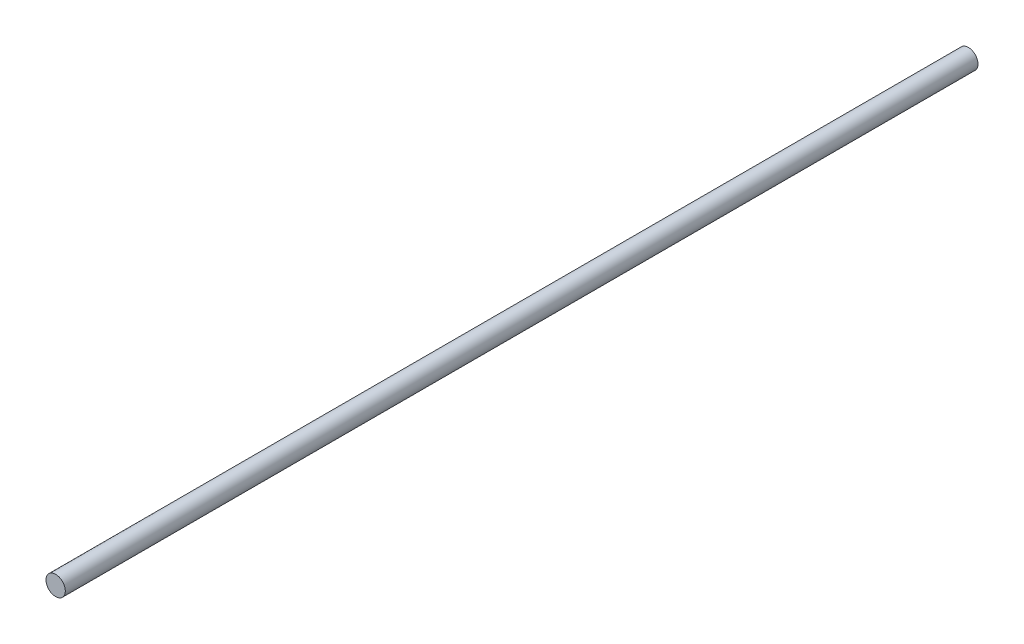
from build123d import *

# Parameters (mm, degrees)
SKETCH1_R           = 6.35
BOSS_EXTRUDE1_DEPTH = 300


with BuildPart() as part:
    # Sketch1 → Boss-Extrude1 (new, symmetric)
    with BuildSketch(Plane.XY):
        Circle(SKETCH1_R)
    extrude(amount=BOSS_EXTRUDE1_DEPTH, both=True)


solid = part.part
